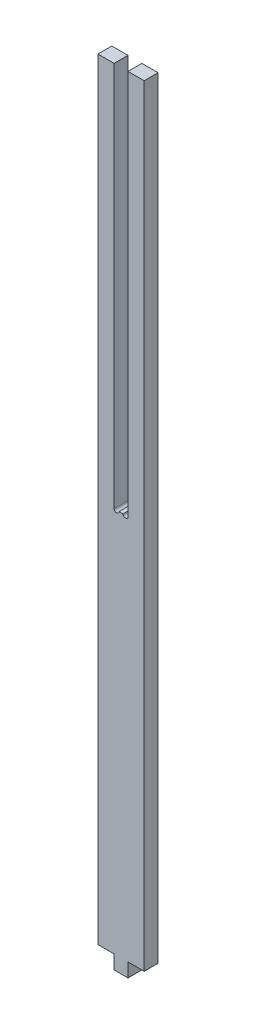
from build123d import *

# Parameters (mm, degrees)
ESTRUSIONE_ESTRUSIONE1_DEPTH = 18


with BuildPart() as part:
    # Schizzo1 → Estrusione-Estrusione1 (new body)
    with BuildSketch(Plane.XY):
        with BuildLine():
            Line((-51.222222222, 825), (-51.222222222, 325))
            ThreePointArc((-51.222222222, 325), (-48.047222222, 321.825), (-44.872222222, 325))
            Line((-44.872222222, 325), (-39.572222222, 325))
            ThreePointArc((-39.572222222, 325), (-36.397222222, 321.825), (-33.222222222, 325))
            Line((-33.222222222, 325), (-33.222222222, 825))
            Line((-33.222222222, 825), (-12.222222222, 825))
            Line((-12.222222222, 825), (-12.222222222, -175))
            Line((-12.222222222, -175), (-33.222222222, -175))
            Line((-33.222222222, -175), (-33.222222222, -193))
            Line((-33.222222222, -193), (-51.222222222, -193))
            Line((-51.222222222, -193), (-51.222222222, -175))
            Line((-51.222222222, -175), (-72.222222222, -175))
            Line((-72.222222222, -175), (-72.222222222, 825))
            Line((-72.222222222, 825), (-51.222222222, 825))
        make_face()
    extrude(amount=ESTRUSIONE_ESTRUSIONE1_DEPTH)


solid = part.part
